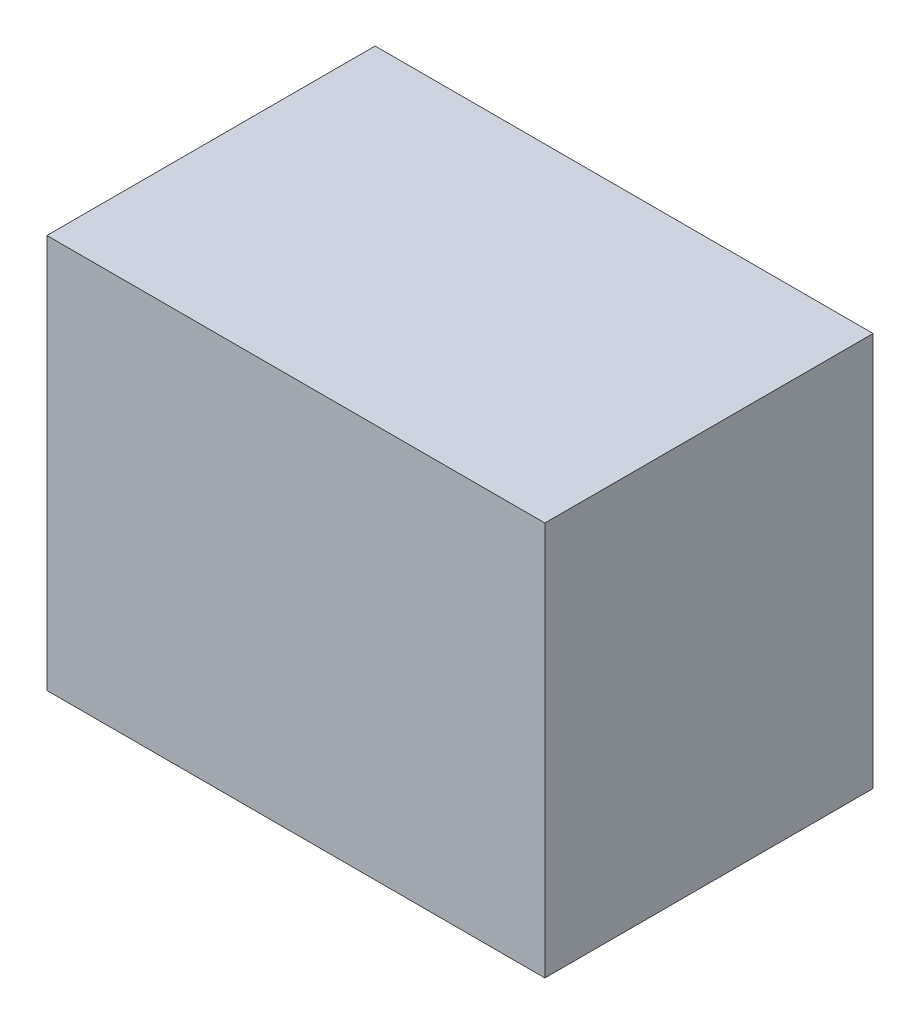
from build123d import *

# Parameters (mm, degrees)
SKETCH1_W           = 48.4
SKETCH1_H           = 38.3
BOSS_EXTRUDE1_DEPTH = 31.9


with BuildPart() as part:
    # Sketch1 → Boss-Extrude1 (new body)
    with BuildSketch(Plane.XY):
        with Locations((24.2, 19.15)):
            Rectangle(SKETCH1_W, SKETCH1_H)
    extrude(amount=BOSS_EXTRUDE1_DEPTH)


solid = part.part
